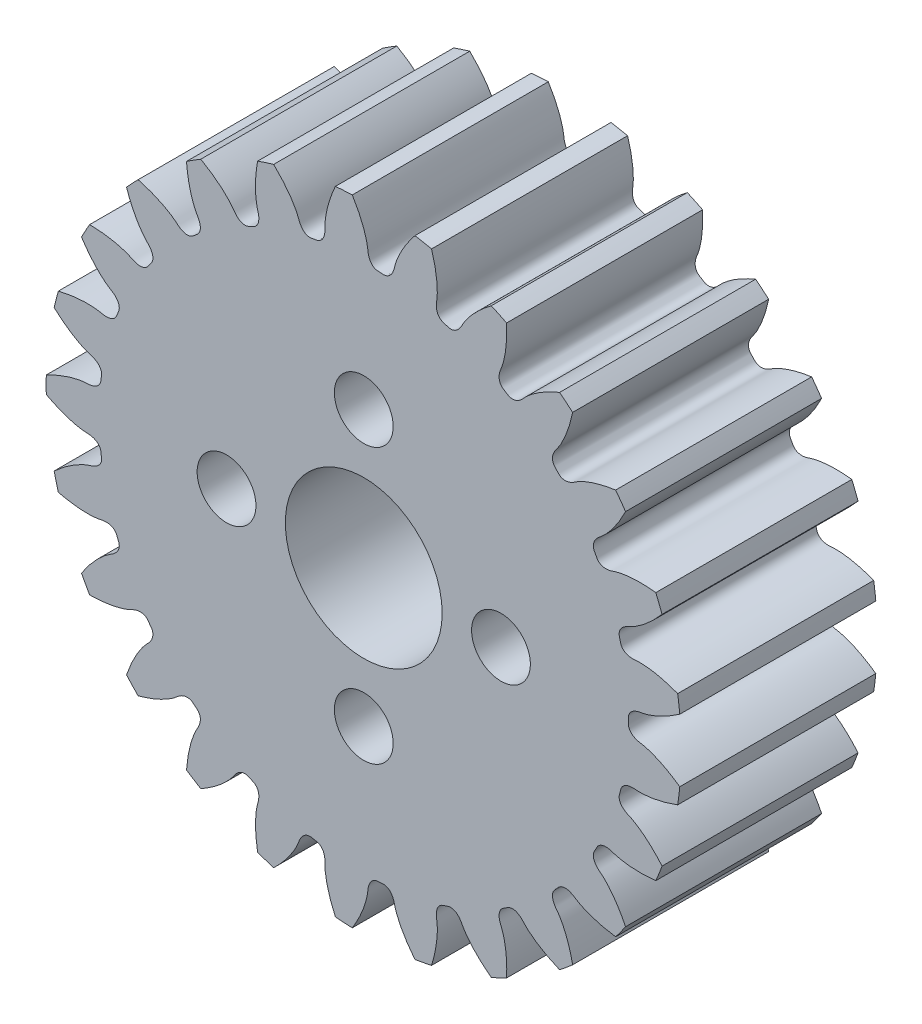
from build123d import *

# Parameters (mm, degrees)
SKETCHREVOLVESPURPINION_W       = 10
SKETCHREVOLVESPURPINION_H       = 16.2
TOOTHEXTRUDECUTSPURPINION_DEPTH = 5
PATTERNSPURPINION_COUNT         = 25
SKETCH_5_R                      = 1.5
SKETCH_5_R_2                    = 4
CUT_EXTRUDE_2_DEPTH             = 25.990733856


with BuildPart() as part:
    # SketchRevolveSpurPinion → SpurPinion (revolve)
    with BuildSketch(Plane(origin=(0, 0, 0), x_dir=(0, 0, -1), z_dir=(1, 0, 0))):
        with Locations((0, 8.1)):
            Rectangle(SKETCHREVOLVESPURPINION_W, SKETCHREVOLVESPURPINION_H)
    revolve(axis=Axis((0, 0, 0), (0, 0, -1)))

    # SketchToothSpurPinion → ToothExtrudeCutSpurPinion (cut, symmetric)
    with BuildSketch(Plane.XY):
        with BuildLine():
            ThreePointArc((16.176949539, 1.64131155), (16.26, 0), (16.176949539, -1.64131155))
            add(Edge.make_bspline(
                [(16.176949539, -1.64131155), (16.057064442, -1.555185472), (15.878534559, -1.434141332), (15.640285153, -1.287564837), (15.47366157, -1.191540766), (15.3146101, -1.105869164), (15.163579769, -1.030030868), (15.020995893, -0.963489445), (14.887259431, -0.905692552), (14.762746515, -0.856072355), (14.647807631, -0.814048066), (14.542768058, -0.779021939), (14.447924402, -0.750396301), (14.363553673, -0.727524102), (14.289883579, -0.709865734), (14.189139149, -0.688427342), (14.100564142, -0.676616162), (14.02345089, -0.658795363), (13.99062552, -0.650369052), (13.958508607, -0.64115397), (13.927053005, -0.631128168), (13.896210548, -0.620227859), (13.865927333, -0.608379692), (13.836145846, -0.595487368), (13.806806316, -0.581429179), (13.777849922, -0.566051493), (13.749224061, -0.549162198), (13.72089091, -0.53052344), (13.692840703, -0.509844879), (13.665111494, -0.486779329), (13.637817118, -0.460924332), (13.611184115, -0.431835426), (13.585595412, -0.399059391), (13.561633135, -0.362196617), (13.540101891, -0.320999835), (13.522012029, -0.27549913), (13.508469957, -0.226142215), (13.501059568, -0.177099539), (13.497878909, -0.101382132), (13.501583443, 0), (13.497878909, 0.101382132), (13.501059568, 0.177099539), (13.508469957, 0.226142215), (13.522012029, 0.27549913), (13.540101891, 0.320999835), (13.561633135, 0.362196617), (13.585595412, 0.399059391), (13.611184115, 0.431835426), (13.637817118, 0.460924332), (13.665111494, 0.486779329), (13.692840703, 0.509844879), (13.72089091, 0.53052344), (13.749224061, 0.549162198), (13.777849922, 0.566051493), (13.806806316, 0.581429179), (13.836145846, 0.595487368), (13.865927333, 0.608379692), (13.896210548, 0.620227859), (13.927053005, 0.631128168), (13.958508607, 0.64115397), (13.99062552, 0.650369052), (14.02345089, 0.658795363), (14.100564142, 0.676616162), (14.189139149, 0.688427342), (14.289883579, 0.709865734), (14.363553673, 0.727524102), (14.447924402, 0.750396301), (14.542768058, 0.779021939), (14.647807631, 0.814048066), (14.762746515, 0.856072355), (14.887259431, 0.905692552), (15.020995893, 0.963489445), (15.163579769, 1.030030868), (15.3146101, 1.105869164), (15.47366157, 1.191540766), (15.640285153, 1.287564837), (15.878534559, 1.434141332), (16.057064442, 1.555185472), (16.176949539, 1.64131155)],
                knots=[0, 0, 0, 0, 0.066592486, 0.097260078, 0.126175237, 0.153337961, 0.178748252, 0.202406109, 0.224311533, 0.244464522, 0.262865078, 0.2795132, 0.294408888, 0.307552142, 0.318942963, 0.32858135, 0.354009635, 0.359185096, 0.364277395, 0.369297063, 0.374256261, 0.37916906, 0.38405178, 0.388923371, 0.393805851, 0.398724764, 0.403709653, 0.408794462, 0.414017764, 0.419422613, 0.425055715, 0.430965484, 0.437198416, 0.443793278, 0.450772917, 0.458134465, 0.465840213, 0.473812957, 0.480450771, 0.5, 0.519549229, 0.526187043, 0.534159787, 0.541865535, 0.549227083, 0.556206722, 0.562801584, 0.569034516, 0.574944285, 0.580577387, 0.585982236, 0.591205538, 0.596290347, 0.601275236, 0.606194149, 0.611076629, 0.61594822, 0.62083094, 0.625743739, 0.630702937, 0.635722605, 0.640814904, 0.645990365, 0.67141865, 0.681057037, 0.692447858, 0.705591112, 0.7204868, 0.737134922, 0.755535478, 0.775688467, 0.797593891, 0.821251748, 0.846662039, 0.873824763, 0.902739922, 0.933407514, 1, 1, 1, 1], degree=3))
        make_face()
    toothextrudecutspurpinion = extrude(amount=TOOTHEXTRUDECUTSPURPINION_DEPTH, both=True, mode=Mode.SUBTRACT)

    # PatternSpurPinion: ToothExtrudeCutSpurPinion ×25 about axis
    patternspurpinion_axis = Axis((0, 0, 50), (0, 0, -1))
    for i in range(1, PATTERNSPURPINION_COUNT):
        add(toothextrudecutspurpinion.rotate(patternspurpinion_axis, i * 360 / PATTERNSPURPINION_COUNT), mode=Mode.SUBTRACT)

    # Эскиз5 → Вырез-Вытянуть2 (cut, through all)
    with BuildSketch(Plane.XY.offset(5)):
        with Locations((0, 7)):
            Circle(SKETCH_5_R)
        with Locations((7, 0)):
            Circle(SKETCH_5_R)
        with Locations((-7, 0)):
            Circle(SKETCH_5_R)
        with Locations((0, -7)):
            Circle(SKETCH_5_R)
        Circle(SKETCH_5_R_2)
    extrude(amount=-CUT_EXTRUDE_2_DEPTH, mode=Mode.SUBTRACT)


solid = part.part
